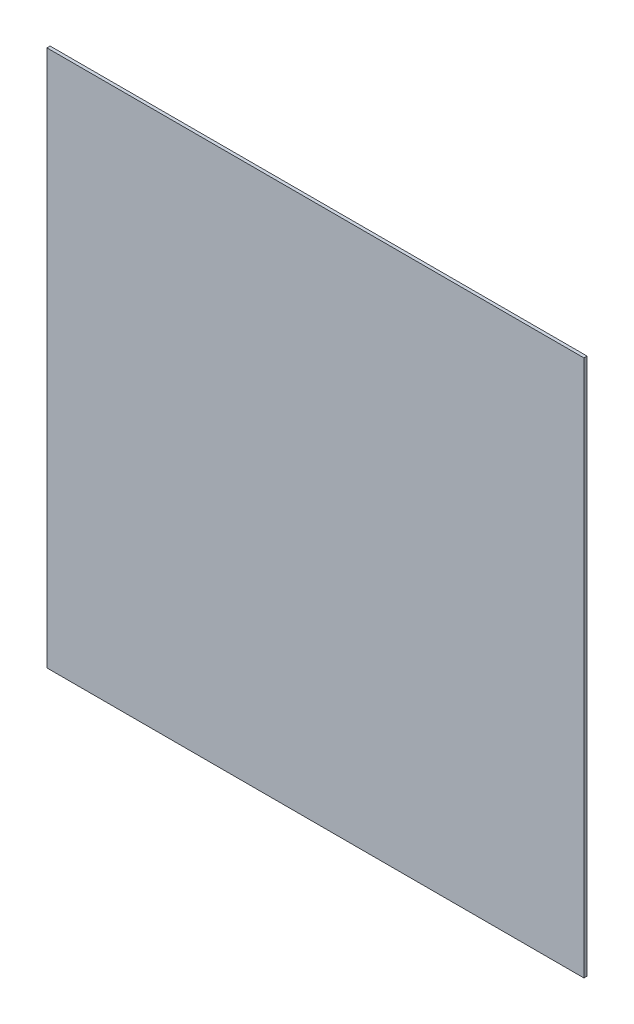
from build123d import *

# Parameters (mm, degrees)
SKETCH1_W           = 510
SKETCH1_H           = 510
BOSS_EXTRUDE1_DEPTH = 3


with BuildPart() as part:
    # Sketch1 → Boss-Extrude1 (new body)
    with BuildSketch(Plane.XY):
        Rectangle(SKETCH1_W, SKETCH1_H)
    extrude(amount=BOSS_EXTRUDE1_DEPTH)


solid = part.part
